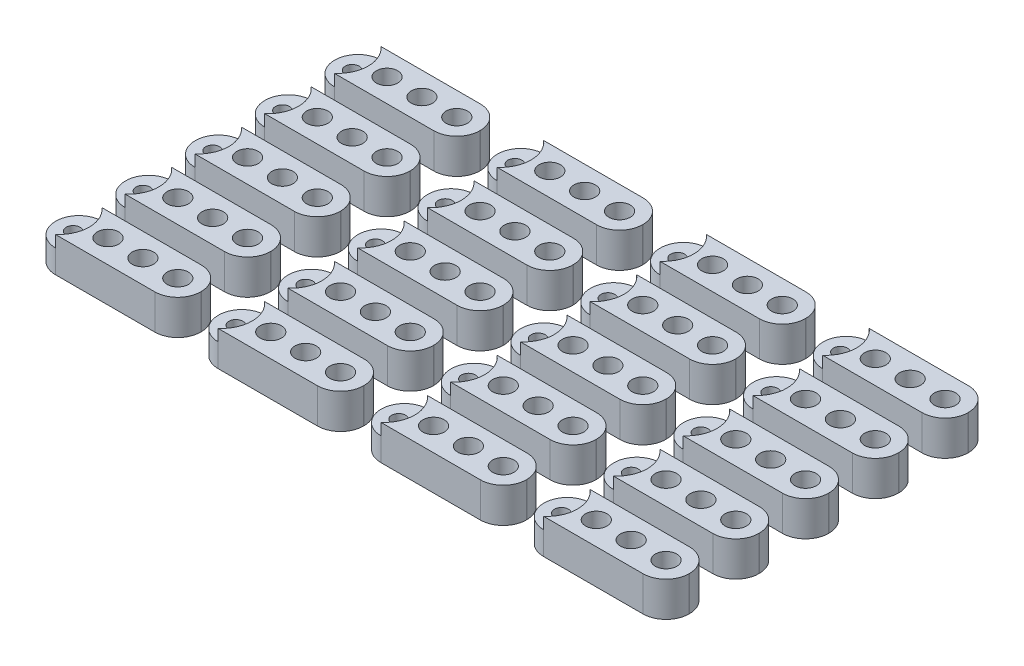
from build123d import *

# Parameters (mm, degrees)
SKETCH1_R           = 0.46
BOSS_EXTRUDE1_DEPTH = 1.5
SKETCH1_3_R         = 0.3
BOSS_EXTRUDE2_DEPTH = 1
LPATTERN1_COUNT     = 5
LPATTERN1_PITCH     = 3
LPATTERN1_2_COUNT   = 4
LPATTERN1_2_PITCH   = 7


with BuildPart() as part:
    # Sketch1 → Boss-Extrude1 (new body)
    with BuildSketch(Plane(origin=(0, 0, 0), x_dir=(1, 0, 0), z_dir=(0, 1, 0))):
        with BuildLine():
            Line((1.51, 1), (-2.76, 1))
            ThreePointArc((-2.76, 1), (-2.307913072, 0), (-2.76, -1))
            Line((-2.76, -1), (1.51, -1))
            ThreePointArc((1.51, -1), (2.210035713, -0.710035713), (2.5, -0.01))
            Line((2.5, -0.01), (2.5, 0.01))
            ThreePointArc((2.5, 0.01), (2.210035713, 0.710035713), (1.51, 1))
        make_face()
        with Locations((-1.5, 0)):
            Circle(SKETCH1_R, mode=Mode.SUBTRACT)
        Circle(SKETCH1_R, mode=Mode.SUBTRACT)
        with Locations((1.5, 0)):
            Circle(SKETCH1_R, mode=Mode.SUBTRACT)
    extrude(amount=BOSS_EXTRUDE1_DEPTH)

    # Sketch1<3> → Boss-Extrude2 (add)
    with BuildSketch(Plane(origin=(0, 0, 0), x_dir=(1, 0, 0), z_dir=(0, 1, 0))):
        with BuildLine():
            ThreePointArc((-2.76, -1), (-2.307913072, 0), (-2.76, 1))
            ThreePointArc((-2.76, 1), (-3.460035713, 0.710035713), (-3.75, 0.01))
            Line((-3.75, 0.01), (-3.75, -0.01))
            ThreePointArc((-3.75, -0.01), (-3.460035713, -0.710035713), (-2.76, -1))
        make_face()
        with Locations((-3, 0)):
            Circle(SKETCH1_3_R, mode=Mode.SUBTRACT)
    extrude(amount=BOSS_EXTRUDE2_DEPTH)


with BuildPart() as lpattern1_1:
    # LPattern1: pattern copy
    add(part.part.moved(Location(Vector(0, 0, 1) * (1 * LPATTERN1_PITCH))))


with BuildPart() as lpattern1_2:
    # LPattern1: pattern copy
    add(part.part.moved(Location(Vector(0, 0, 1) * (2 * LPATTERN1_PITCH))))


with BuildPart() as lpattern1_3:
    # LPattern1: pattern copy
    add(part.part.moved(Location(Vector(0, 0, 1) * (3 * LPATTERN1_PITCH))))


with BuildPart() as lpattern1_4:
    # LPattern1: pattern copy
    add(part.part.moved(Location(Vector(0, 0, 1) * (4 * LPATTERN1_PITCH))))


with BuildPart() as lpattern1_2_1:
    # LPattern1 2: pattern copy
    add(part.part.moved(Location(Vector(1, 0, 0) * (1 * LPATTERN1_2_PITCH))))


with BuildPart() as lpattern1_2_2:
    # LPattern1 2: pattern copy
    add(part.part.moved(Location(Vector(1, 0, 0) * (2 * LPATTERN1_2_PITCH))))


with BuildPart() as lpattern1_2_3:
    # LPattern1 2: pattern copy
    add(part.part.moved(Location(Vector(1, 0, 0) * (3 * LPATTERN1_2_PITCH))))


with BuildPart() as lpattern1_2_4:
    # LPattern1 2: pattern copy
    add(lpattern1_1.part.moved(Location(Vector(1, 0, 0) * (1 * LPATTERN1_2_PITCH))))


with BuildPart() as lpattern1_2_5:
    # LPattern1 2: pattern copy
    add(lpattern1_1.part.moved(Location(Vector(1, 0, 0) * (2 * LPATTERN1_2_PITCH))))


with BuildPart() as lpattern1_2_6:
    # LPattern1 2: pattern copy
    add(lpattern1_1.part.moved(Location(Vector(1, 0, 0) * (3 * LPATTERN1_2_PITCH))))


with BuildPart() as lpattern1_2_7:
    # LPattern1 2: pattern copy
    add(lpattern1_2.part.moved(Location(Vector(1, 0, 0) * (1 * LPATTERN1_2_PITCH))))


with BuildPart() as lpattern1_2_8:
    # LPattern1 2: pattern copy
    add(lpattern1_2.part.moved(Location(Vector(1, 0, 0) * (2 * LPATTERN1_2_PITCH))))


with BuildPart() as lpattern1_2_9:
    # LPattern1 2: pattern copy
    add(lpattern1_2.part.moved(Location(Vector(1, 0, 0) * (3 * LPATTERN1_2_PITCH))))


with BuildPart() as lpattern1_2_10:
    # LPattern1 2: pattern copy
    add(lpattern1_3.part.moved(Location(Vector(1, 0, 0) * (1 * LPATTERN1_2_PITCH))))


with BuildPart() as lpattern1_2_11:
    # LPattern1 2: pattern copy
    add(lpattern1_3.part.moved(Location(Vector(1, 0, 0) * (2 * LPATTERN1_2_PITCH))))


with BuildPart() as lpattern1_2_12:
    # LPattern1 2: pattern copy
    add(lpattern1_3.part.moved(Location(Vector(1, 0, 0) * (3 * LPATTERN1_2_PITCH))))


with BuildPart() as lpattern1_2_13:
    # LPattern1 2: pattern copy
    add(lpattern1_4.part.moved(Location(Vector(1, 0, 0) * (1 * LPATTERN1_2_PITCH))))


with BuildPart() as lpattern1_2_14:
    # LPattern1 2: pattern copy
    add(lpattern1_4.part.moved(Location(Vector(1, 0, 0) * (2 * LPATTERN1_2_PITCH))))


with BuildPart() as lpattern1_2_15:
    # LPattern1 2: pattern copy
    add(lpattern1_4.part.moved(Location(Vector(1, 0, 0) * (3 * LPATTERN1_2_PITCH))))


solid = Compound([part.part, lpattern1_1.part, lpattern1_2.part, lpattern1_3.part, lpattern1_4.part, lpattern1_2_1.part, lpattern1_2_2.part, lpattern1_2_3.part, lpattern1_2_4.part, lpattern1_2_5.part, lpattern1_2_6.part, lpattern1_2_7.part, lpattern1_2_8.part, lpattern1_2_9.part, lpattern1_2_10.part, lpattern1_2_11.part, lpattern1_2_12.part, lpattern1_2_13.part, lpattern1_2_14.part, lpattern1_2_15.part])
